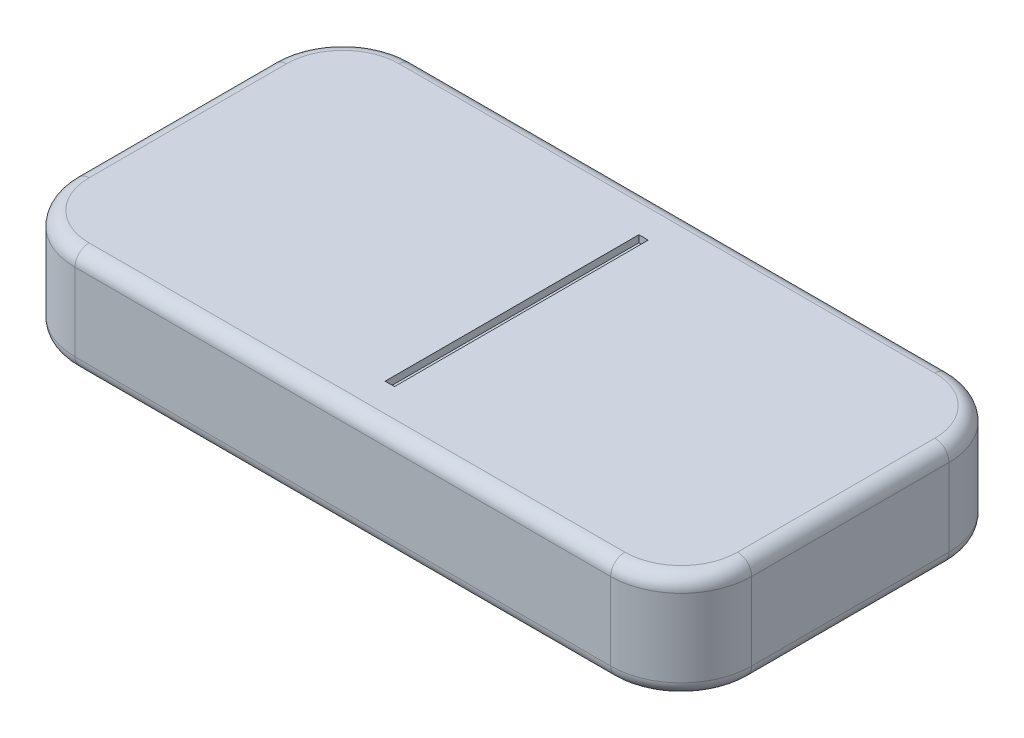
from build123d import *

# Parameters (mm, degrees)
ESQUISSE1_W      = 48
ESQUISSE1_H      = 24
EXTRUSION1_DEPTH = 7.5
CONG_2_R         = 5
CONG_5_R         = 1
CONG_6_R         = 1
ESQUISSE3_W      = 0.662191978
ESQUISSE3_H      = 18
EXTRUSION2_DEPTH = 0.5


with BuildPart() as part:
    # Esquisse1 → Extrusion1 (new body)
    with BuildSketch(Plane(origin=(0, 0, 0), x_dir=(1, 0, 0), z_dir=(0, 1, 0))):
        with Locations((24, 12)):
            Rectangle(ESQUISSE1_W, ESQUISSE1_H)
    extrude(amount=EXTRUSION1_DEPTH)

    # Congé2
    cong_2_edges = [part.edges().sort_by_distance(p)[0] for p in [
        (0, 3.75, -24),
        (48, 3.75, -24),
        (48, 3.75, 0),
        (0, 3.75, 0),
    ]]
    fillet(cong_2_edges, radius=CONG_2_R)

    # Congé5
    cong_5_edges = [part.edges().sort_by_distance(p)[0] for p in [
        (48, 7.5, -12),
        (24, 7.5, 0),
        (0, 7.5, -12),
        (24, 7.5, -24),
        (1.464466094, 7.5, -22.535533906),
        (1.464466094, 7.5, -1.464466094),
        (46.535533906, 7.5, -22.535533906),
        (46.535533906, 7.5, -1.464466094),
    ]]
    fillet(cong_5_edges, radius=CONG_5_R)

    # Congé6
    cong_6_edges = [part.edges().sort_by_distance(p)[0] for p in [
        (48, 0, -12),
        (0, 0, -12),
        (24, 0, -24),
        (24, 0, 0),
        (1.464466094, 0, -22.535533906),
        (1.464466094, 0, -1.464466094),
        (46.535533906, 0, -22.535533906),
        (46.535533906, 0, -1.464466094),
    ]]
    fillet(cong_6_edges, radius=CONG_6_R)

    # Esquisse3 → Extrusion2 (cut)
    with BuildSketch(Plane(origin=(0, 7.5, 0), x_dir=(1, 0, 0), z_dir=(0, 1, 0))):
        with Locations((24.331095989, 12)):
            Rectangle(ESQUISSE3_W, ESQUISSE3_H)
    extrude(amount=-EXTRUSION2_DEPTH, mode=Mode.SUBTRACT)


solid = part.part
